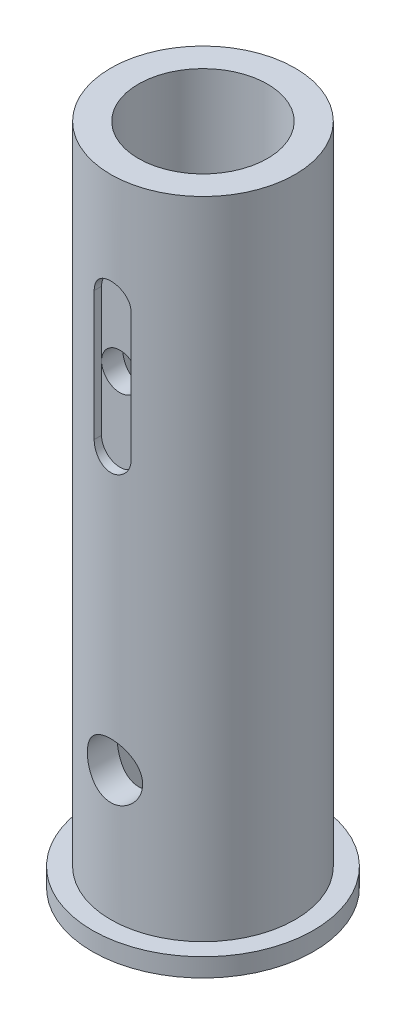
from build123d import *
from build123d.topology import SkipClean

# Parameters (mm, degrees)
SKETCH2_R                = 12
SKETCH2_R_2              = 10
BOSS_EXTRUDE1_DEPTH      = 2
BOSS_EXTRUDE2_DEPTH      = 70
BOSS_EXTRUDE2_DEPTH_BACK = 2
SKETCH2_2_R              = 10
SKETCH3_R                = 7
CUT_EXTRUDE1_DEPTH       = 74.972968036
SKETCH4_R                = 3
CUT_EXTRUDE2_DEPTH       = 73.027772421
SKETCH4_4_R              = 2
CUT_EXTRUDE3_DEPTH       = 73.027772519
CUT_EXTRUDE4_DEPTH       = 73.027772519
BOSS_EXTRUDE3_DEPTH      = 9
CUT_EXTRUDE5_DEPTH       = 74.972968133
SKETCH6_R                = 2
CUT_EXTRUDE6_DEPTH       = 9


with BuildPart() as part:
    # Sketch2 → Boss-Extrude1 (new body)
    with BuildSketch(Plane(origin=(0, 0, 0), x_dir=(1, 0, 0), z_dir=(0, 1, 0))):
        with Locations(Location((0, 0, 0), (0, 0, 270))):
            Circle(SKETCH2_R)
        with Locations(Location((0, 0, 0), (0, 0, 270))):
            Circle(SKETCH2_R_2, mode=Mode.SUBTRACT)
    extrude(amount=-BOSS_EXTRUDE1_DEPTH)

    # Sketch2<2> → Boss-Extrude2 (add, two sides: drawn at the far end of the back side and taken through both)
    with BuildSketch(Plane(origin=(0, 0, 0), x_dir=(1, 0, 0), z_dir=(0, 1, 0)).offset(-BOSS_EXTRUDE2_DEPTH_BACK)):
        with Locations(Location((0, 0, 0), (0, 0, 270))):
            Circle(SKETCH2_2_R)
    extrude(amount=BOSS_EXTRUDE2_DEPTH + BOSS_EXTRUDE2_DEPTH_BACK)

    # Sketch3 → Cut-Extrude1 (cut, through all)
    with BuildSketch(Plane(origin=(0, 70, 0), x_dir=(1, 0, 0), z_dir=(0, 1, 0))):
        with Locations(Location((0, 0, 0), (0, 0, 270))):
            Circle(SKETCH3_R)
    extrude(amount=-CUT_EXTRUDE1_DEPTH, mode=Mode.SUBTRACT)

    # Sketch4 → Cut-Extrude2 (cut, through all)
    with BuildSketch(Plane.XY):
        with Locations(Location((0, 14, 0), (0, 0, 270))):
            Circle(SKETCH4_R)
    extrude(amount=CUT_EXTRUDE2_DEPTH, mode=Mode.SUBTRACT)

    # Sketch4<4> → Cut-Extrude3 (cut, through all)
    with BuildSketch(Plane.XY):
        with Locations(Location((0, 51, 0), (0, 0, 90))):
            Circle(SKETCH4_4_R)
    extrude(amount=CUT_EXTRUDE3_DEPTH, mode=Mode.SUBTRACT)

    # Sketch4<6> → Cut-Extrude4 (cut, through all)
    with BuildSketch(Plane.XY):
        with BuildLine():
            Line((-2, 44), (-2, 58))
            ThreePointArc((-2, 58), (0, 60), (2, 58))
            Line((2, 58), (2, 44))
            ThreePointArc((2, 44), (0, 42), (-2, 44))
        make_face()
    extrude(amount=CUT_EXTRUDE4_DEPTH, mode=Mode.SUBTRACT)

    # Sketch4<7> → Boss-Extrude3 (add)
    with BuildSketch(Plane.XY):
        with BuildLine():
            Line((-2, 44), (-2, 58))
            ThreePointArc((-2, 58), (0, 60), (2, 58))
            Line((2, 58), (2, 44))
            ThreePointArc((2, 44), (0, 42), (-2, 44))
        make_face()
    extrude(amount=BOSS_EXTRUDE3_DEPTH)

    # Sketch5 → Cut-Extrude5 (cut, through all)
    with BuildSketch(Plane(origin=(0, 70, 0), x_dir=(1, 0, 0), z_dir=(0, 1, 0))):
        with BuildLine():
            Line((3.011686508, -6.318998685), (3.944683927, 2.018210381))
            Line((3.944683927, 2.018210381), (-3.137399774, 2.238378786))
            Line((-3.137399774, 2.238378786), (-2.673709916, -6.469256161))
            ThreePointArc((-2.673709916, -6.469256161), (0.184936128, -6.997556618), (3.011686508, -6.318998685))
        make_face()
    extrude(amount=-CUT_EXTRUDE5_DEPTH, mode=Mode.SUBTRACT)

    # Sketch6 → Cut-Extrude6 (cut)
    with SkipClean():  # the faces are left unmerged after this step: merging them gives an invalid solid
        with BuildSketch(Plane.XY.offset(9)):
            with Locations((0, 51)):
                Circle(SKETCH6_R)
        extrude(amount=-CUT_EXTRUDE6_DEPTH, mode=Mode.SUBTRACT)


solid = part.part
